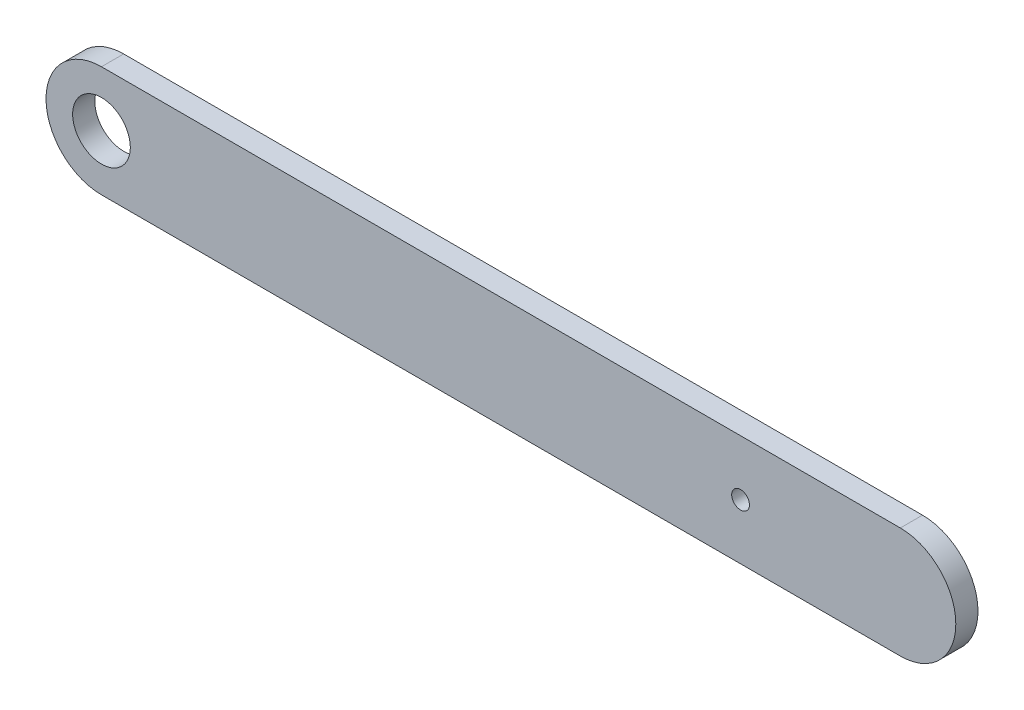
from build123d import *

# Parameters (mm, degrees)
SKETCH1_R           = 6.5
SKETCH1_R_2         = 2
BOSS_EXTRUDE1_DEPTH = 5
SKETCH2_R           = 1.6
CUT_EXTRUDE1_DEPTH  = 10


with BuildPart() as part:
    # Sketch1 → Boss-Extrude1 (new body)
    with BuildSketch(Plane.XY):
        with BuildLine():
            Line((0, 12.5), (180, 12.5))
            ThreePointArc((180, 12.5), (192.5, 0), (180, -12.5))
            Line((180, -12.5), (0, -12.5))
            ThreePointArc((0, -12.5), (-12.5, 0), (0, 12.5))
        make_face()
        Circle(SKETCH1_R, mode=Mode.SUBTRACT)
        with Locations((144, 0)):
            Circle(SKETCH1_R_2, mode=Mode.SUBTRACT)
    extrude(amount=BOSS_EXTRUDE1_DEPTH)

    # Sketch2 → Cut-Extrude1 (cut)
    with BuildSketch(Plane.XZ.offset(12.5)):
        with Locations(Location((175, 2.5, 0), (0, 0, 270))):
            Circle(SKETCH2_R)
    extrude(amount=-CUT_EXTRUDE1_DEPTH, mode=Mode.SUBTRACT)


solid = part.part
